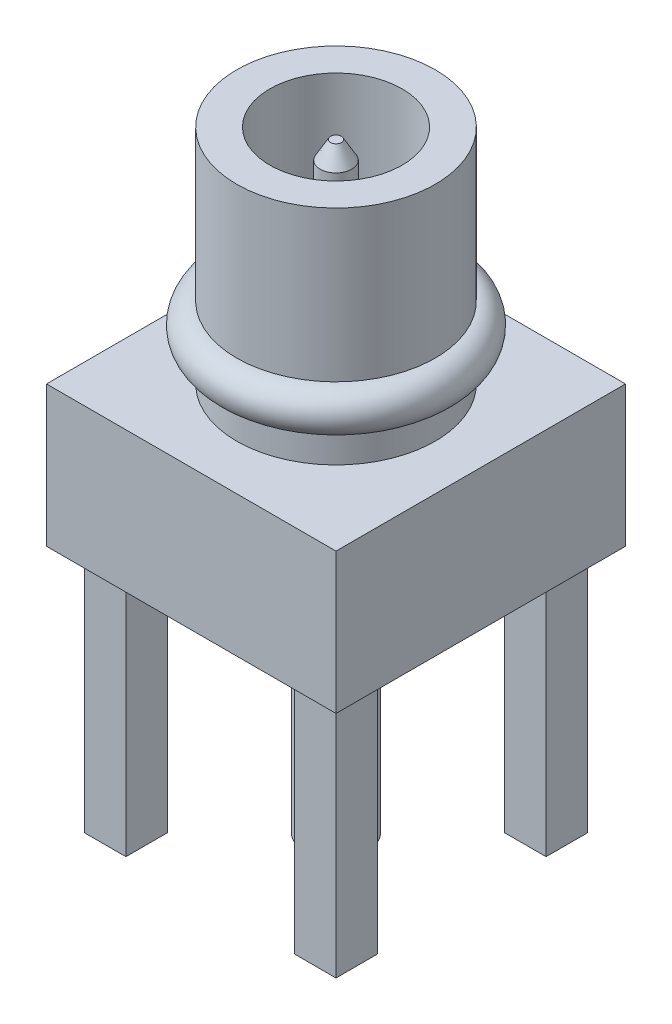
from build123d import *

# Parameters (mm, degrees)
SKETCH1_W           = 3.5
SKETCH1_H           = 3.5
BOSS_EXTRUDE1_DEPTH = 1.7
SKETCH2_R           = 1.2
BOSS_EXTRUDE2_DEPTH = 2.69
SKETCH4_R           = 0.25
SKETCH5_R           = 0.381
SKETCH5_W           = 0.5
SKETCH5_H           = 0.5
BOSS_EXTRUDE3_DEPTH = 3
CUT_EXTRUDE1_START  = -0.001
SKETCH6_R           = 1
SKETCH6_R_2         = 0.381
CUT_EXTRUDE1_DEPTH  = 0.001


with BuildPart() as part:
    # Sketch1 → Boss-Extrude1 (new body)
    with BuildSketch(Plane(origin=(0, 0, 0), x_dir=(1, 0, 0), z_dir=(0, 1, 0))):
        Rectangle(SKETCH1_W, SKETCH1_H)
    extrude(amount=BOSS_EXTRUDE1_DEPTH)

    # Sketch2 → Boss-Extrude2 (add)
    with BuildSketch(Plane(origin=(0, 1.7, 0), x_dir=(1, 0, 0), z_dir=(0, 1, 0))):
        Circle(SKETCH2_R)
    extrude(amount=BOSS_EXTRUDE2_DEPTH)

    # Sketch3 → Cut-Revolve1 (revolve, cut)
    with BuildSketch(Plane(origin=(0, 0, 0), x_dir=(0, 0, -1), z_dir=(1, 0, 0))):
        Polygon((0, 4.39), (0, 4.26), (0.0655, 4.26), (0.1905, 4.043493649), (0.1905, 2.94), (0.8, 2.94), (0.8, 4.39), align=None)
    revolve(axis=Axis((0, 0, 0), (0, 1, 0)), mode=Mode.SUBTRACT)

    # Sketch4 → Revolve1 (revolve)
    with BuildSketch(Plane(origin=(0, 0, 0), x_dir=(0, 0, -1), z_dir=(1, 0, 0))):
        with Locations((-1.2, 2.32)):
            Circle(SKETCH4_R)
    revolve(axis=Axis((0, 0, 0), (0, 1, 0)))

    # Sketch5 → Boss-Extrude3 (add)
    with BuildSketch(Plane.XZ):
        Circle(SKETCH5_R)
        with Locations((-1.27, -1.27)):
            Rectangle(SKETCH5_W, SKETCH5_H)
        with Locations((1.27, -1.27)):
            Rectangle(SKETCH5_W, SKETCH5_H)
        with Locations((-1.27, 1.27)):
            Rectangle(SKETCH5_W, SKETCH5_H)
        with Locations((1.27, 1.27)):
            Rectangle(SKETCH5_W, SKETCH5_H)
    extrude(amount=BOSS_EXTRUDE3_DEPTH)

    # Sketch6 → Cut-Extrude1 (cut)
    with BuildSketch(Plane.XZ.offset(CUT_EXTRUDE1_START)):
        Circle(SKETCH6_R)
        Circle(SKETCH6_R_2, mode=Mode.SUBTRACT)
    extrude(amount=CUT_EXTRUDE1_DEPTH, mode=Mode.SUBTRACT)


solid = part.part
